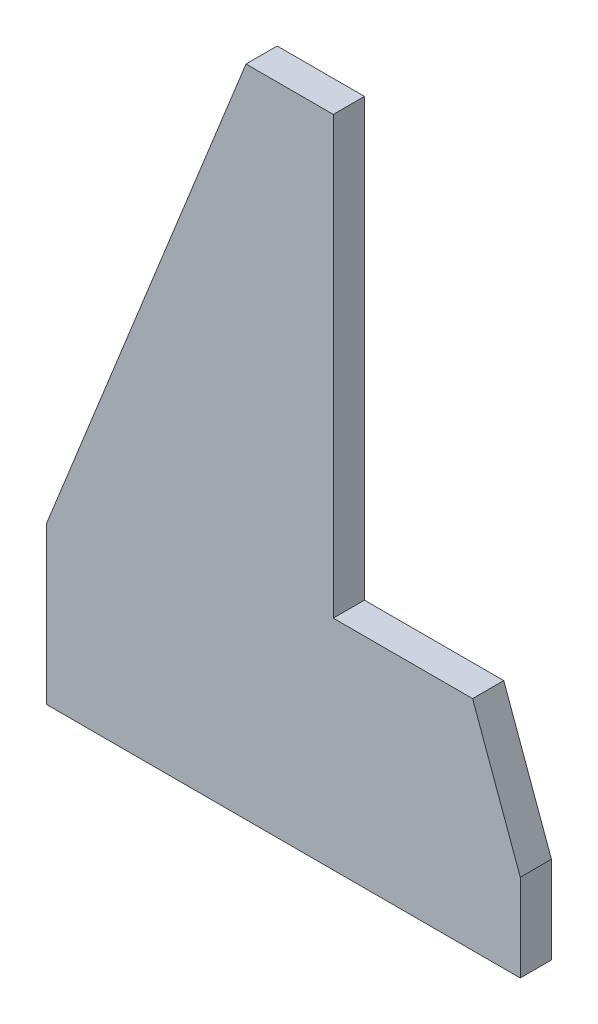
from build123d import *

# Parameters (mm, degrees)
Y_KSEKLIK_EKSTR_ZYON1_DEPTH = 10
CUT_EXTRUDE1_DEPTH          = 10


with BuildPart() as part:
    # Çizim1 → Yükseklik-Ekstrüzyon1 (new body)
    with BuildSketch(Plane.XY):
        Polygon((-210, 28), (-210, 0), (0, 0), (0, 28), (-15.3, 70), (-60, 70), (-60, 210), (-88, 210), align=None)
    extrude(amount=Y_KSEKLIK_EKSTR_ZYON1_DEPTH)

    # Sketch1 → Cut-Extrude1 (cut)
    with BuildSketch(Plane(origin=(0, 0, 0), x_dir=(-1, 0, 0), z_dir=(0, 0, -1))):
        Polygon((152, 150.469052626), (245.176581689, 150.469052626), (245.176581689, -14.338775046), (152, -14.338775046), (152, 50.347137768), (88, 210), (152, 210), align=None)
    extrude(amount=-CUT_EXTRUDE1_DEPTH, mode=Mode.SUBTRACT)


solid = part.part
